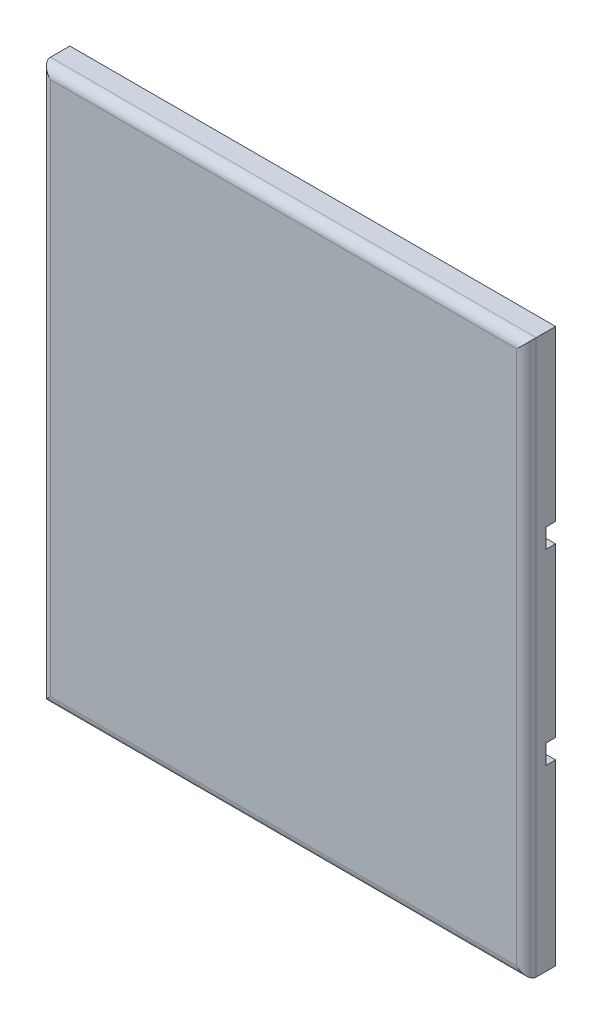
from build123d import *

# Parameters (mm, degrees)
SKETCH1_W           = 500
SKETCH1_H           = 570
BOSS_EXTRUDE1_DEPTH = 30
FILLET1_R           = 10
SKETCH3_W           = 500
SKETCH3_H           = 20
SKETCH3_W_2         = 24.124551532
SKETCH3_W_3         = 40.885345678
SKETCH3_W_4         = 75.086674906
CUT_EXTRUDE1_DEPTH  = 10


with BuildPart() as part:
    # Sketch1 → Boss-Extrude1 (new body)
    with BuildSketch(Plane.XY):
        with Locations((-250, -285)):
            Rectangle(SKETCH1_W, SKETCH1_H)
    extrude(amount=BOSS_EXTRUDE1_DEPTH)

    # Fillet1
    fillet1_edges = [part.edges().sort_by_distance(p)[0] for p in [
        (-500, -285, 30),
        (-250, -570, 30),
        (0, -285, 30),
        (-250, 0, 30),
    ]]
    fillet(fillet1_edges, radius=FILLET1_R)

    # Sketch3 → Cut-Extrude1 (cut)
    with BuildSketch(Plane.XY):
        with Locations((-250, -376.410467709)):
            Rectangle(SKETCH3_W, SKETCH3_H)
        with Locations((-512.062275766, -376.410467709)):
            Rectangle(SKETCH3_W_2, SKETCH3_H)
        with Locations((12.062275766, -376.410467709)):
            Rectangle(SKETCH3_W_2, SKETCH3_H)
        with Locations((20.442672839, -183.821390857)):
            Rectangle(SKETCH3_W_3, SKETCH3_H)
        with Locations((-250, -183.821390857)):
            Rectangle(SKETCH3_W, SKETCH3_H)
        with Locations((-537.543337453, -183.821390857)):
            Rectangle(SKETCH3_W_4, SKETCH3_H)
    extrude(amount=CUT_EXTRUDE1_DEPTH, mode=Mode.SUBTRACT)


solid = part.part
